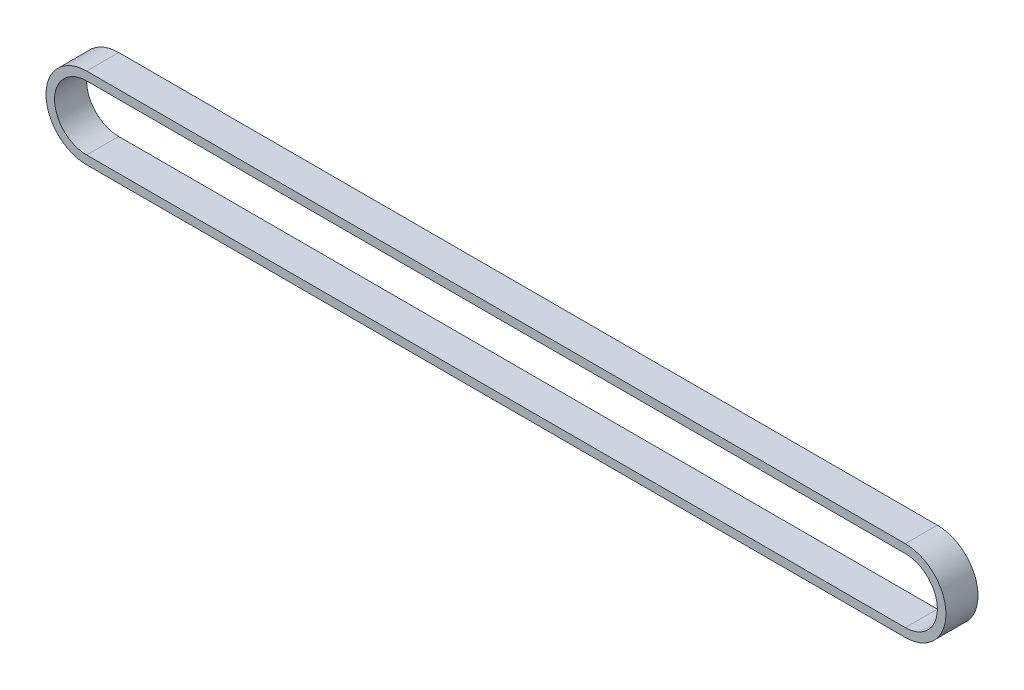
from build123d import *

# Parameters (mm, degrees)
EXTRUDE_1_DEPTH = 15


with BuildPart() as part:
    # 草图1 → 凸台-拉伸1 (new body)
    with BuildSketch(Plane.XY):
        with BuildLine():
            Line((0, 19), (383, 19))
            ThreePointArc((383, 19), (402, 0), (383, -19))
            Line((383, -19), (0, -19))
            ThreePointArc((0, -19), (-19, 0), (0, 19))
        make_face()
        with BuildLine():
            Line((0, 15), (383, 15))
            ThreePointArc((383, 15), (398, 0), (383, -15))
            Line((383, -15), (0, -15))
            ThreePointArc((0, -15), (-15, 0), (0, 15))
        make_face(mode=Mode.SUBTRACT)
    extrude(amount=EXTRUDE_1_DEPTH)


solid = part.part
